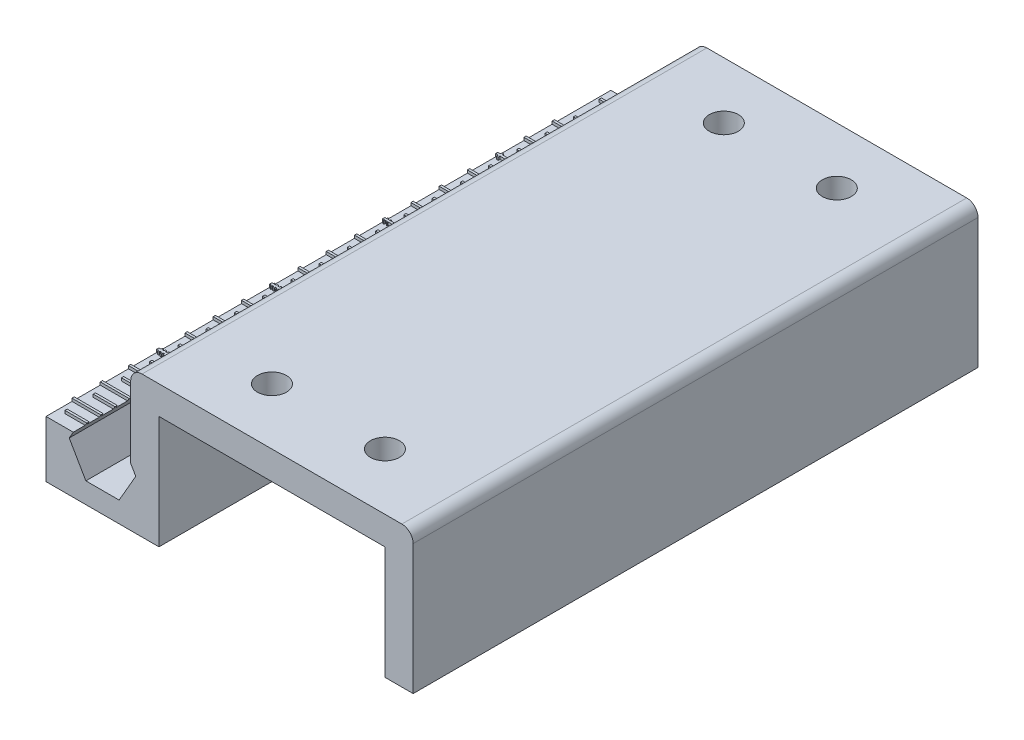
from build123d import *

# Parameters (mm, degrees)
BOSS_EXTRUDE2_DEPTH = 127
THE_RULER_W         = 6.669403244
THE_RULER_H         = 0.508
THE_RULER_W_2       = 5.08
BOSS_EXTRUDE6_DEPTH = 13.335
CUT_EXTRUDE1_DEPTH  = 127
SKETCH10_R          = 3.2639
CUT_EXTRUDE2_DEPTH  = 143.839717866


with BuildPart() as part:
    # Sketch1 → Boss-Extrude2 (new body)
    with BuildSketch(Plane.XY):
        with BuildLine():
            Line((50.8, 0), (57.15, 0))
            Line((57.15, 0), (57.15, 29.21))
            ThreePointArc((57.15, 29.21), (56.406051224, 31.006051224), (54.61, 31.75))
            Line((54.61, 31.75), (-3.81, 31.75))
            ThreePointArc((-3.81, 31.75), (-5.606051224, 31.006051224), (-6.35, 29.21))
            Line((-6.35, 29.21), (-6.35, 13.067977372))
            Line((-6.35, 13.067977372), (-5.221004613, 11.1125))
            Line((-5.221004613, 11.1125), (-8.960502306, 4.6355))
            Line((-8.960502306, 4.6355), (-16.439497694, 4.6355))
            Line((-16.439497694, 4.6355), (-20.178995387, 11.1125))
            Line((-20.178995387, 11.1125), (-19.262451835, 12.7))
            Line((-19.262451835, 12.7), (-25.4, 12.7))
            Line((-25.4, 12.7), (-25.4, 0))
            Line((-25.4, 0), (0, 0))
            Line((0, 0), (0, 25.4))
            Line((0, 25.4), (50.8, 25.4))
            Line((50.8, 25.4), (50.8, 0))
        make_face()
    extrude(amount=BOSS_EXTRUDE2_DEPTH)

    # THE RULER → Boss-Extrude6 (add)
    with BuildSketch(Plane(origin=(0, 0, 0), x_dir=(1, 0, 0), z_dir=(0, 1, 0))):
        with Locations((-22.065298378, -12.954)):
            Rectangle(THE_RULER_W, THE_RULER_H)
        with Locations((-21.270596756, -35.179)):
            Rectangle(THE_RULER_W_2, THE_RULER_H)
        Polygon((-24.153376967, -51.308), (-24.153376967, -51.584005443), (-24.29736963, -51.584005443), (-24.29736963, -51.308), (-24.805558384, -51.308), (-24.805558384, -51.584005443), (-25.034254998, -51.584005443), (-25.034254998, -51.308), (-25.4, -51.308), (-25.4, -50.8), (-25.034254998, -50.8), (-25.034254998, -50.547467514), (-24.805558384, -50.547467514), (-24.805558384, -50.8), (-24.29736963, -50.8), (-24.29736963, -50.531005937), (-24.153376967, -50.531005937), (-24.153376967, -50.8), (-18.730596756, -50.8), (-18.730596756, -51.308), align=None)
        with Locations((-21.270596756, -54.229)):
            Rectangle(THE_RULER_W_2, THE_RULER_H)
        with Locations((-22.065298378, -57.404)):
            Rectangle(THE_RULER_W, THE_RULER_H)
        with Locations((-22.065298378, -63.754)):
            Rectangle(THE_RULER_W, THE_RULER_H)
        with Locations((-22.065298378, -70.104)):
            Rectangle(THE_RULER_W, THE_RULER_H)
        Polygon((-23.426490036, -76.708), (-23.426490036, -76.994970777), (-23.70340887, -76.994970777), (-23.70340887, -76.708), (-24.153376967, -76.708), (-24.153376967, -76.994970777), (-24.423685308, -76.994970777), (-24.423685308, -76.708), (-24.805558384, -76.708), (-24.805558384, -76.994970777), (-25.034254998, -76.994970777), (-25.034254998, -76.708), (-25.4, -76.708), (-25.4, -76.2), (-25.034254998, -76.2), (-25.034254998, -75.975694542), (-24.805558384, -75.975694542), (-24.805558384, -76.2), (-24.423685308, -76.2), (-24.423685308, -75.955015619), (-24.153376967, -75.955015619), (-24.153376967, -76.2), (-23.70340887, -76.2), (-23.70340887, -75.918827503), (-23.426490036, -75.918827503), (-23.426490036, -76.2), (-18.730596756, -76.2), (-18.730596756, -76.708), align=None)
        with Locations((-21.270596756, -98.679)):
            Rectangle(THE_RULER_W_2, THE_RULER_H)
        with Locations((-22.065298378, -95.504)):
            Rectangle(THE_RULER_W, THE_RULER_H)
        with Locations((-21.270596756, -92.329)):
            Rectangle(THE_RULER_W_2, THE_RULER_H)
        with Locations((-22.065298378, -89.154)):
            Rectangle(THE_RULER_W, THE_RULER_H)
        with Locations((-21.270596756, -85.979)):
            Rectangle(THE_RULER_W_2, THE_RULER_H)
        with Locations((-22.065298378, -82.804)):
            Rectangle(THE_RULER_W, THE_RULER_H)
        with Locations((-21.270596756, -79.629)):
            Rectangle(THE_RULER_W_2, THE_RULER_H)
        Polygon((-24.647702548, -102.108), (-24.647702548, -102.393984646), (-24.937399925, -102.393984646), (-24.937399925, -102.108), (-25.4, -102.108), (-25.4, -101.6), (-24.937399925, -101.6), (-24.937399925, -101.281517608), (-24.647702548, -101.281517608), (-24.647702548, -101.6), (-24.29736963, -101.6), (-24.29736963, -101.281517608), (-23.986830406, -101.281517608), (-23.986830406, -101.6), (-23.588496513, -101.6), (-23.588496513, -101.247593904), (-23.208268705, -101.247593904), (-23.208268705, -101.6), (-22.801754068, -101.6), (-22.801754068, -101.264555756), (-22.46829669, -101.264555756), (-22.46829669, -101.6), (-18.730596756, -101.6), (-18.730596756, -102.108), (-22.46829669, -102.108), (-22.46829669, -102.475462033), (-22.801754068, -102.475462033), (-22.801754068, -102.108), (-23.208268705, -102.108), (-23.208268705, -102.475462033), (-23.588496513, -102.475462033), (-23.588496513, -102.108), (-23.986830406, -102.108), (-23.986830406, -102.475462033), (-24.29736963, -102.475462033), (-24.29736963, -102.108), align=None)
        with Locations((-21.270596756, -105.029)):
            Rectangle(THE_RULER_W_2, THE_RULER_H)
        with Locations((-22.065298378, -108.204)):
            Rectangle(THE_RULER_W, THE_RULER_H)
        with Locations((-21.270596756, -111.379)):
            Rectangle(THE_RULER_W_2, THE_RULER_H)
        with Locations((-22.065298378, -114.554)):
            Rectangle(THE_RULER_W, THE_RULER_H)
        with Locations((-21.270596756, -117.729)):
            Rectangle(THE_RULER_W_2, THE_RULER_H)
        with Locations((-21.270596756, -124.079)):
            Rectangle(THE_RULER_W_2, THE_RULER_H)
        with Locations((-22.065298378, -120.904)):
            Rectangle(THE_RULER_W, THE_RULER_H)
        with Locations((-21.802451835, -3.429)):
            Rectangle(THE_RULER_W_2, THE_RULER_H)
        with Locations((-21.270596756, -9.779)):
            Rectangle(THE_RULER_W_2, THE_RULER_H)
        with Locations((-21.270596756, -16.129)):
            Rectangle(THE_RULER_W_2, THE_RULER_H)
        with Locations((-22.065298378, -19.304)):
            Rectangle(THE_RULER_W, THE_RULER_H)
        with Locations((-21.270596756, -22.479)):
            Rectangle(THE_RULER_W_2, THE_RULER_H)
        Polygon((-24.423685308, -25.4), (-18.730596756, -25.4), (-18.730596756, -25.908), (-24.423685308, -25.908), (-24.423685308, -26.314653152), (-24.805558384, -26.314653152), (-24.805558384, -25.908), (-25.4, -25.908), (-25.4, -25.4), (-24.805558384, -25.4), (-24.805558384, -25.062958071), (-24.423685308, -25.062958071), align=None)
        with Locations((-21.270596756, -28.829)):
            Rectangle(THE_RULER_W_2, THE_RULER_H)
        with Locations((-22.065298378, -32.004)):
            Rectangle(THE_RULER_W, THE_RULER_H)
        with Locations((-22.065298378, -38.354)):
            Rectangle(THE_RULER_W, THE_RULER_H)
        with Locations((-21.270596756, -41.529)):
            Rectangle(THE_RULER_W_2, THE_RULER_H)
        with Locations((-22.065298378, -44.704)):
            Rectangle(THE_RULER_W, THE_RULER_H)
        with Locations((-21.270596756, -47.879)):
            Rectangle(THE_RULER_W_2, THE_RULER_H)
        with Locations((-21.270596756, -60.579)):
            Rectangle(THE_RULER_W_2, THE_RULER_H)
        with Locations((-21.270596756, -66.929)):
            Rectangle(THE_RULER_W_2, THE_RULER_H)
        with Locations((-21.270596756, -73.279)):
            Rectangle(THE_RULER_W_2, THE_RULER_H)
    extrude(amount=BOSS_EXTRUDE6_DEPTH)

    # Sketch9 → Cut-Extrude1 (cut)
    with BuildSketch(Plane.XY.offset(127)):
        Polygon((-8.960502306, 17.5895), (-16.439497694, 17.5895), (-20.178995387, 11.1125), (-16.439497694, 4.6355), (-8.960502306, 4.6355), (-5.221004613, 11.1125), align=None)
    extrude(amount=-CUT_EXTRUDE1_DEPTH, mode=Mode.SUBTRACT)

    # Sketch10 → Cut-Extrude2 (cut, through all)
    with BuildSketch(Plane(origin=(0, 31.75, 0), x_dir=(1, 0, 0), z_dir=(0, 1, 0))):
        with Locations(Location((12.7, -12.7, 0), (0, 0, 180))):
            Circle(SKETCH10_R)
        with Locations(Location((38.1, -12.7, 0), (0, 0, 180))):
            Circle(SKETCH10_R)
        with Locations(Location((38.1, -114.3, 0), (0, 0, 270))):
            Circle(SKETCH10_R)
        with Locations(Location((12.7, -114.3, 0), (0, 0, 270))):
            Circle(SKETCH10_R)
    extrude(amount=-CUT_EXTRUDE2_DEPTH, mode=Mode.SUBTRACT)


solid = part.part
